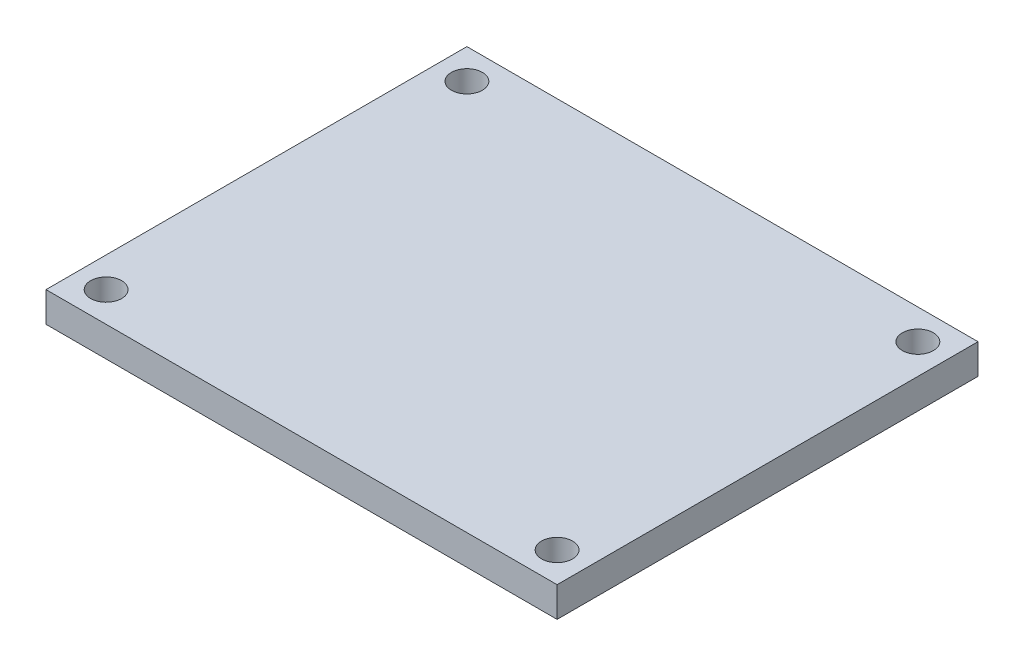
from build123d import *

# Parameters (mm, degrees)
SKETCH2_W           = 85
SKETCH2_H           = 70
SKETCH2_R           = 2.58
BOSS_EXTRUDE1_DEPTH = 5


with BuildPart() as part:
    # Sketch2 → Boss-Extrude1 (new body)
    with BuildSketch(Plane(origin=(0, 0, 0), x_dir=(1, 0, 0), z_dir=(0, 1, 0))):
        with Locations((42.5, 35)):
            Rectangle(SKETCH2_W, SKETCH2_H)
        with Locations(Location((5, 5, 0), (0, 0, 270))):
            Circle(SKETCH2_R, mode=Mode.SUBTRACT)
        with Locations(Location((80, 5, 0), (0, 0, 90))):
            Circle(SKETCH2_R, mode=Mode.SUBTRACT)
        with Locations(Location((80, 65, 0), (0, 0, 270))):
            Circle(SKETCH2_R, mode=Mode.SUBTRACT)
        with Locations(Location((5, 65, 0), (0, 0, 90))):
            Circle(SKETCH2_R, mode=Mode.SUBTRACT)
    extrude(amount=BOSS_EXTRUDE1_DEPTH)


solid = part.part
